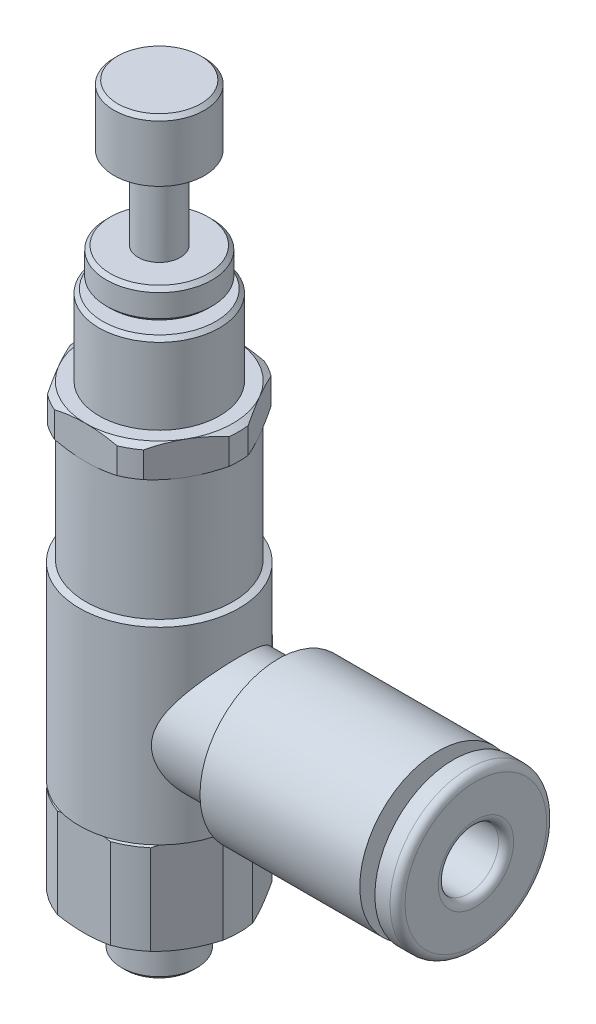
from build123d import *

# Parameters (mm, degrees)
NUT_TOP_DEPTH               = 2.2
NUT_BOT_DEPTH               = 6.3
NUT_ROUNDS_DEPTH            = 25.203994161
NUT_ROUNDS_DEPTH_BACK       = 25.203994161
NUT_ROUNDS_SKETCH_OUTSIDE_W = 20.176
NUT_ROUNDS_SKETCH_OUTSIDE_H = 19.228
NUT_ROUNDS_SKETCH_OUTSIDE_R = 5.3
THREADS_SKETCH_R            = 2.5
THREADS_DEPTH               = 3.5
THREADS_MGT_SKETCH_R        = 4
THREADS_MGT_DEPTH           = 5.3
LOC_SPACER_SKETCH_R         = 2
LOC_SPACER_DEPTH            = 0.5
LOC_ADJUSTER_SKETCH_R       = 3.5
LOC_ADJUSTER_DEPTH          = 2
TUBE_SKETCH_R               = 2
TUBE_DEPTH                  = 13
TUBE_ROUDS_R                = 0.5
PROFILE_PORT_R              = 1.25
CHAM_SIZE                   = 0.25


with BuildPart() as part:
    # MBody_Sketch → MBody (revolve)
    with BuildSketch(Plane.XY, mode=Mode.PRIVATE) as mbody_sk:
        Polygon((0, 17.2), (-4.875, 17.2), (-4.875, 6.95468735), (-5.3, 6.8), (-5.3, -5.7), (0, -5.7), align=None)
    revolve(mbody_sk.sketch.rotate(Axis((0, 0, 0), (0, 1, 0)), 270), axis=Axis((0, 0, 0), (0, 1, 0)))

    # Nut Top_Sketch → Nut Top (add)
    with BuildSketch(Plane(origin=(0, 17.2, 0), x_dir=(-1, 0, 0), z_dir=(0, 1, 0))):
        Polygon((-2.814582562, 4.875), (-5.629165125, 0), (-2.814582562, -4.875), (2.814582562, -4.875), (5.629165125, 0), (2.814582562, 4.875), align=None)
    extrude(amount=-NUT_TOP_DEPTH)

    # Nut Cham Top_Sketch → Nut Cham Top (revolve, cut)
    with BuildSketch(Plane.XY):
        Polygon((5.629165125, 17.2), (4.875, 17.2), (5.629165125, 16.764582562), align=None)
        Polygon((5.629165125, 15.435417438), (5.629165125, 15), (4.875, 15), align=None)
    revolve(axis=Axis((0, 0, 0), (0, 1, 0)), mode=Mode.SUBTRACT)

    # Nut Bot_Sketch → Nut Bot (add)
    with BuildSketch(Plane.XZ.offset(5.7)):
        Polygon((2.886751346, -5), (5.773502692, 0), (2.886751346, 5), (-2.886751346, 5), (-5.773502692, 0), (-2.886751346, -5), align=None)
    extrude(amount=NUT_BOT_DEPTH)

    # Nut Cham Bot_Sketch → Nut Cham Bot (revolve, cut)
    with BuildSketch(Plane.XY):
        Polygon((5.773502692, -5.7), (5, -5.7), (5.773502692, -6.146581987), align=None)
        Polygon((5.773502692, -11.553418013), (5.773502692, -12), (5, -12), align=None)
    revolve(axis=Axis((0, -2.270147765, 0), (0, -1, 0)), mode=Mode.SUBTRACT)

    # Nut Rounds_Sketch outside → Nut Rounds (cut, two sides: drawn at the far end of the back side and taken through both)
    with BuildSketch(Plane(origin=(0, -5.7, 0), x_dir=(-1, 0, 0), z_dir=(0, 1, 0)).offset(-NUT_ROUNDS_DEPTH_BACK)):
        Rectangle(NUT_ROUNDS_SKETCH_OUTSIDE_W, NUT_ROUNDS_SKETCH_OUTSIDE_H)
        with Locations(Location((0, 0, 0), (0, 0, 270))):
            Circle(NUT_ROUNDS_SKETCH_OUTSIDE_R, mode=Mode.SUBTRACT)
    extrude(amount=NUT_ROUNDS_DEPTH + NUT_ROUNDS_DEPTH_BACK, mode=Mode.SUBTRACT)

    # Threads_Sketch → Threads (add)
    with BuildSketch(Plane(origin=(0, -12, 0), x_dir=(-1, 0, 0), z_dir=(0, 1, 0))):
        with Locations(Location((0, 0, 0), (0, 0, 90))):
            Circle(THREADS_SKETCH_R)
    extrude(amount=-THREADS_DEPTH)

    # Threads MGT_Sketch → Threads MGT (add)
    with BuildSketch(Plane(origin=(0, 17.2, 0), x_dir=(-1, 0, 0), z_dir=(0, 1, 0))):
        with Locations(Location((0, 0, 0), (0, 0, 270))):
            Circle(THREADS_MGT_SKETCH_R)
    extrude(amount=THREADS_MGT_DEPTH)

    # Adjuster_Sketch → Adjuster (revolve)
    with BuildSketch(Plane.XY, mode=Mode.PRIVATE) as adjuster_sk:
        Polygon((0, 17.2), (0, 34.5), (3, 34.5), (3, 30.5), (1.4, 30.5), (1.4, 17.2), align=None)
    revolve(adjuster_sk.sketch.rotate(Axis((0, 0, 0), (0, 1, 0)), 90), axis=Axis((0, 0, 0), (0, 1, 0)))

    # Loc Spacer_Sketch → Loc Spacer (add)
    with BuildSketch(Plane(origin=(0, 22.5, 0), x_dir=(-1, 0, 0), z_dir=(0, 1, 0))):
        with Locations(Location((0, 0, 0), (0, 0, 90))):
            Circle(LOC_SPACER_SKETCH_R)
    extrude(amount=LOC_SPACER_DEPTH)

    # Loc Adjuster_Sketch → Loc Adjuster (add)
    with BuildSketch(Plane(origin=(0, 23, 0), x_dir=(-1, 0, 0), z_dir=(0, 1, 0))):
        with Locations(Location((0, 0, 0), (0, 0, 90))):
            Circle(LOC_ADJUSTER_SKETCH_R)
    extrude(amount=LOC_ADJUSTER_DEPTH)

    # RBody_Sketch → RBody (revolve)
    with BuildSketch(Plane.XY, mode=Mode.PRIVATE) as rbody_sk:
        Polygon((0, 0), (0, 4), (7.463235719, 4), (7.9, 5.2), (18.5, 5.2), (18.5, 0), align=None)
    revolve(rbody_sk.sketch.rotate(Axis((0, 0, 0), (1, 0, 0)), 90), axis=Axis((0, 0, 0), (1, 0, 0)))

    # Release_Sketch → Release (revolve)
    with BuildSketch(Plane.XY, mode=Mode.PRIVATE) as release_sk:
        Polygon((18.5, 0), (18.5, 2.75), (19.5, 2.75), (19.5, 5.2), (21, 5.2), (21, 0), align=None)
    revolve(release_sk.sketch.rotate(Axis((0, 0, 0), (1, 0, 0)), 90), axis=Axis((0, 0, 0), (1, 0, 0)))

    # Tube_Sketch → Tube (cut)
    with BuildSketch(Plane(origin=(21, 0, 0), x_dir=(0, 0, -1), z_dir=(1, 0, 0))):
        Circle(TUBE_SKETCH_R)
    extrude(amount=-TUBE_DEPTH, mode=Mode.SUBTRACT)

    # Tube Rouds
    tube_rouds_edges = [part.edges().sort_by_distance(p)[0] for p in [
        (21, 0, -5.2),
        (21, 0, 2),
    ]]
    fillet(tube_rouds_edges, radius=TUBE_ROUDS_R)

    # Port: sweep along a path in Path Port
    with BuildLine(Plane.XY) as port_path:
        Line((21, 0), (3, 0))
        ThreePointArc((3, 0), (0.878679656, -0.878679656), (0, -3))
        Line((0, -3), (0, -15.5))
    # Profile Port → Port (sweep, cut)
    with BuildSketch(Plane(origin=(21, 0, 0), x_dir=(0, 0, -1), z_dir=(1, 0, 0))):
        Circle(PROFILE_PORT_R)
    sweep(path=port_path.line, mode=Mode.SUBTRACT)

    # Cham
    cham_edges = [part.edges().sort_by_distance(p)[0] for p in [
        (0, -15.5, -2.5),
        (0, 22.5, 4),
        (0, 34.5, 3),
        (0, 23, -3.5),
        (0, 25, -3.5),
    ]]
    chamfer(cham_edges, length=CHAM_SIZE)


solid = part.part
